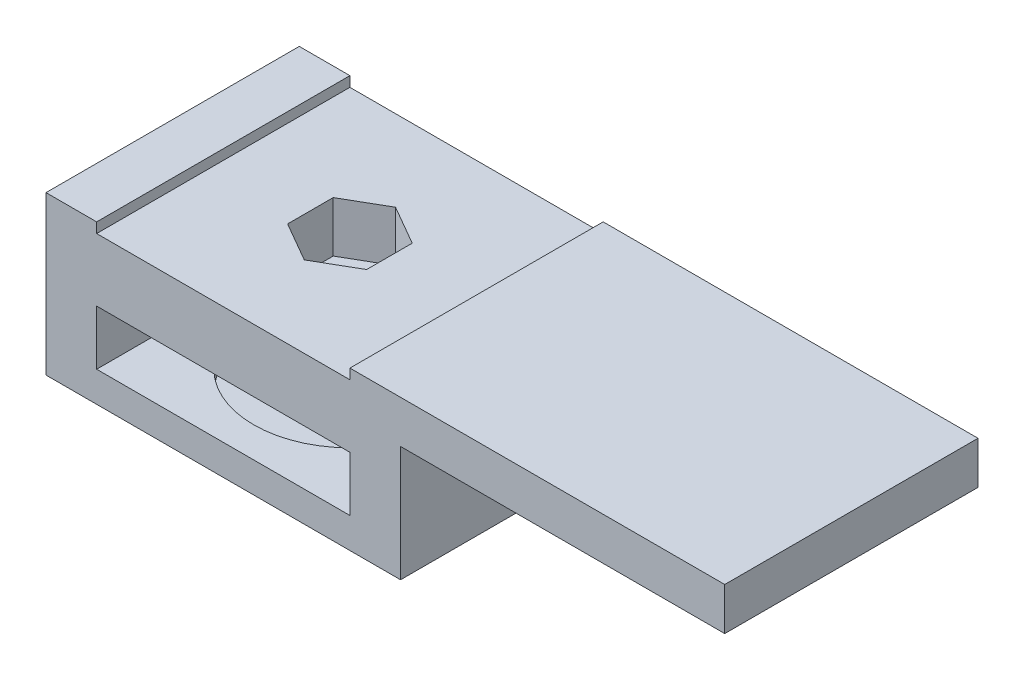
from build123d import *

# Parameters (mm, degrees)
SKETCH1_W              = 25
SKETCH1_H              = 25
SKETCH1_R              = 9.5
ALONGSIDE_WASHER_DEPTH = 2
SKETCH2_W              = 25
SKETCH2_H              = 25
BELOW_WASHER_DEPTH     = 1
SKETCH3_W              = 5
SKETCH3_H              = 25
UPRIGHT_1_DEPTH        = 15.6
SKETCH4_W              = 25
SKETCH4_H              = 1.2
BOSS_EXTRUDE4_DEPTH    = 25
SKETCH5_R              = 2.75
CUT_EXTRUDE1_DEPTH     = 1.2
BOSS_EXTRUDE5_START    = -1.2
SKETCH6_W              = 25
SKETCH6_H              = 25
BOSS_EXTRUDE5_DEPTH    = 6.2
SKETCH7_R              = 3.1
CUT_EXTRUDE2_DEPTH     = 40.930063862
SKETCH8_W              = 25
SKETCH8_H              = 4.2
BOSS_EXTRUDE6_DEPTH    = 37
BOSS_EXTRUDE7_START    = -1
SKETCH9_R              = 1
BOSS_EXTRUDE7_DEPTH    = 1


with BuildPart() as part:
    # Sketch1 → alongside washer (new body)
    with BuildSketch(Plane(origin=(0, 0, 0), x_dir=(1, 0, 0), z_dir=(0, 1, 0))):
        Rectangle(SKETCH1_W, SKETCH1_H)
        with Locations(Location((0, 0, 0), (0, 0, 270))):
            Circle(SKETCH1_R, mode=Mode.SUBTRACT)
    extrude(amount=ALONGSIDE_WASHER_DEPTH)

    # Sketch2 → below washer (add)
    with BuildSketch(Plane.XZ):
        Rectangle(SKETCH2_W, SKETCH2_H)
    extrude(amount=BELOW_WASHER_DEPTH)

    # Sketch3 → upright 1 (add)
    with BuildSketch(Plane.XZ.offset(1)):
        with Locations((-15, 0)):
            Rectangle(SKETCH3_W, SKETCH3_H)
    upright_1 = extrude(amount=-UPRIGHT_1_DEPTH)

    # Sketch4 → Boss-Extrude4 (add)
    with BuildSketch(Plane(origin=(-12.5, 0, 0), x_dir=(0, 0, -1), z_dir=(1, 0, 0))):
        with Locations((0, 8)):
            Rectangle(SKETCH4_W, SKETCH4_H)
    extrude(amount=BOSS_EXTRUDE4_DEPTH)

    # Sketch5 → Cut-Extrude1 (cut)
    with BuildSketch(Plane(origin=(0, 8.6, 0), x_dir=(1, 0, 0), z_dir=(0, 1, 0))):
        with Locations(Location((0, 0, 0), (0, 0, 270))):
            Circle(SKETCH5_R)
    extrude(amount=-CUT_EXTRUDE1_DEPTH, mode=Mode.SUBTRACT)

    # Sketch6 → Boss-Extrude5 (add)
    with BuildSketch(Plane(origin=(0, 8.6, 0), x_dir=(1, 0, 0), z_dir=(0, 1, 0)).offset(BOSS_EXTRUDE5_START)):
        Rectangle(SKETCH6_W, SKETCH6_H)
        Polygon((3.9, 2.25166605), (0, 4.5033321), (-3.9, 2.25166605), (-3.9, -2.25166605), (0, -4.5033321), (3.9, -2.25166605), align=None, mode=Mode.SUBTRACT)
    extrude(amount=BOSS_EXTRUDE5_DEPTH)

    # Mirror1: upright 1 across plane
    add(upright_1.mirror(Plane(origin=(0, 0, 0), x_dir=(0, 0, 1), z_dir=(1, 0, 0))))

    # Sketch7 → Cut-Extrude2 (cut, through all)
    with BuildSketch(Plane(origin=(17.5, 0, 0), x_dir=(0, 0, -1), z_dir=(1, 0, 0))):
        with Locations((0, 5.2)):
            Circle(SKETCH7_R)
    extrude(amount=-CUT_EXTRUDE2_DEPTH, mode=Mode.SUBTRACT)

    # Sketch8 → Boss-Extrude6 (add)
    with BuildSketch(Plane(origin=(12.5, 0, 0), x_dir=(0, 0, -1), z_dir=(1, 0, 0))):
        with Locations((0, 12.5)):
            Rectangle(SKETCH8_W, SKETCH8_H)
    extrude(amount=BOSS_EXTRUDE6_DEPTH)

    # Sketch9 → Boss-Extrude7 (add)
    with BuildSketch(Plane.ZY.offset(-12.5).offset(BOSS_EXTRUDE7_START)):
        with BuildLine():
            ThreePointArc((-2.184032967, 7.4), (-1.191532166, 2.338138526), (3.1, 5.2))
            ThreePointArc((3.1, 5.2), (2.861861474, 6.391532166), (2.184032967, 7.4))
            ThreePointArc((2.184032967, 7.4), (0, 8.3), (-2.184032967, 7.4))
        make_face()
        with Locations((0, 5.2)):
            Circle(SKETCH9_R, mode=Mode.SUBTRACT)
    extrude(amount=BOSS_EXTRUDE7_DEPTH)


solid = part.part
